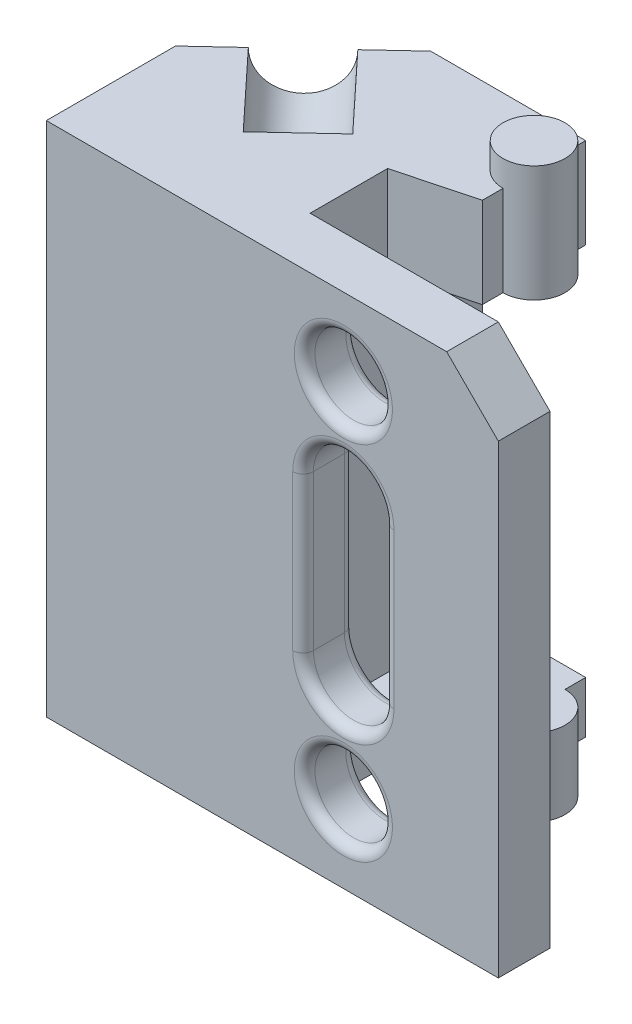
from build123d import *

# Parameters (mm, degrees)
BOSS_EXTRUDE1_DEPTH      = 100
BOSS_EXTRUDE2_DEPTH      = 5
BOSS_EXTRUDE2_DEPTH_BACK = 105
SKETCH2_R                = 6
CUT_EXTRUDE7_DEPTH       = 129.443507792
CUT_EXTRUDE7_DEPTH_BACK  = 20
SKETCH4_W                = 44.006383114
SKETCH4_H                = 72.5
SKETCH5_R                = 7.5
CUT_EXTRUDE8_DEPTH       = 143.090661712
FILLET1_R                = 2
CHAMFER1_SIZE            = 10
SKETCH6_R                = 7.5
CUT_EXTRUDE9_DEPTH       = 20


with BuildPart() as part:
    # Sketch1 → Boss-Extrude1 (new body)
    with BuildSketch(Plane(origin=(0, 0, 0), x_dir=(1, 0, 0), z_dir=(0, 1, 0))):
        Polygon((0, 0), (-87.5, 0), (-87.5, 25), (-61.935274621, 48.839492089), (-31.935274621, 48.839492089), (-31.935274621, 28.839492089), (-46.435560843, 25), (-46.435560843, 10), (0, 10), align=None)
    extrude(amount=BOSS_EXTRUDE1_DEPTH)

    # Sketch2 → Boss-Extrude2 (add, two sides: drawn at the far end of the back side and taken through both)
    with BuildSketch(Plane(origin=(0, 100, 0), x_dir=(1, 0, 0), z_dir=(0, 1, 0)).offset(-BOSS_EXTRUDE2_DEPTH_BACK)):
        with Locations(Location((-31.935274621, 38.839492089, 0), (0, 0, 270))):
            Circle(SKETCH2_R)
    extrude(amount=BOSS_EXTRUDE2_DEPTH + BOSS_EXTRUDE2_DEPTH_BACK)

    # Sketch4 → Cut-Extrude7 (cut, two sides: drawn at the far end of the back side and taken through both)
    with BuildSketch(Plane(origin=(-31.935274621, 0, 0), x_dir=(0, 0, -1), z_dir=(1, 0, 0)).offset(-CUT_EXTRUDE7_DEPTH_BACK)):
        with Locations((32.748434583, 46.25)):
            Rectangle(SKETCH4_W, SKETCH4_H)
    extrude(amount=CUT_EXTRUDE7_DEPTH + CUT_EXTRUDE7_DEPTH_BACK, mode=Mode.SUBTRACT)

    # Sketch5 → Cut-Extrude8 (cut, through all)
    with BuildSketch(Plane(origin=(0, 0, -10), x_dir=(-1, 0, 0), z_dir=(0, 0, -1))):
        with Locations((30, 15)):
            Circle(SKETCH5_R)
        with Locations((30, 85)):
            Circle(SKETCH5_R)
        with BuildLine():
            Line((22.201190531, 35), (22.201190531, 65))
            ThreePointArc((22.201190531, 65), (30, 72.798809469), (37.798809469, 65))
            Line((37.798809469, 65), (37.798809469, 35))
            ThreePointArc((37.798809469, 35), (30, 27.201190531), (22.201190531, 35))
        make_face()
    extrude(amount=-CUT_EXTRUDE8_DEPTH, mode=Mode.SUBTRACT)

    # Fillet1
    fillet1_edges = [part.edges().sort_by_distance(p)[0] for p in [
        (-22.5, 15, 0),
        (-22.5, 15, -10),
        (-22.5, 85, 0),
        (-22.5, 85, -10),
        (-30, 27.201190531, 0),
        (-22.201190531, 50, 0),
        (-30, 72.798809469, 0),
        (-37.798809469, 50, 0),
        (-30, 27.201190531, -10),
        (-37.798809469, 50, -10),
        (-30, 72.798809469, -10),
        (-22.201190531, 50, -10),
    ]]
    fillet(fillet1_edges, radius=FILLET1_R)

    # Chamfer1
    chamfer1_edges = [part.edges().sort_by_distance(p)[0] for p in [
        (0, 100, -5),
    ]]
    chamfer(chamfer1_edges, length=CHAMFER1_SIZE)

    # Sketch6 → Cut-Extrude9 (cut)
    with BuildSketch(Plane(origin=(-53.167704902, 0, -57.015383121), x_dir=(-0.7313537016191667, 0, 0.6819983600625026), z_dir=(-0.6819983600625026, 0, -0.7313537016191667))):
        with Locations((29.465814367, 100)):
            Circle(SKETCH6_R)
    extrude(amount=-CUT_EXTRUDE9_DEPTH, mode=Mode.SUBTRACT)


solid = part.part
